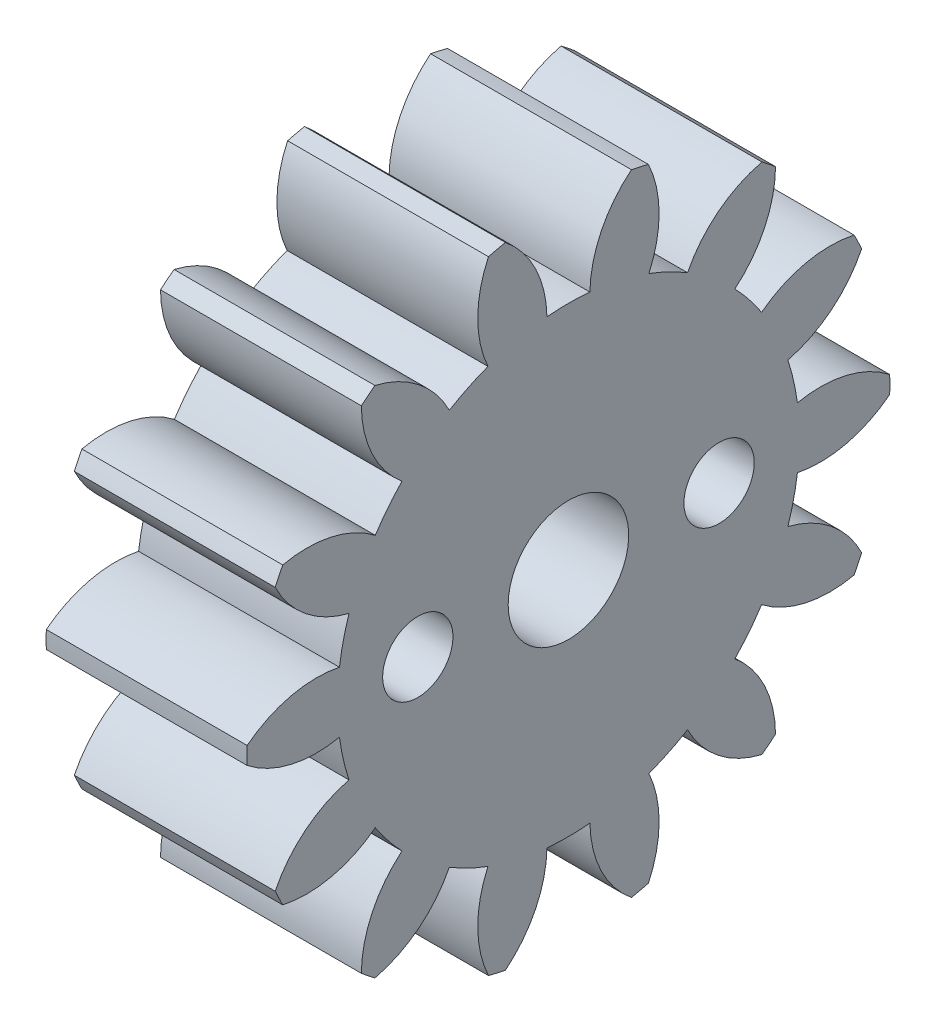
from build123d import *

# Parameters (mm, degrees)
BASPROSKE_W        = 10
BASPROSKE_H        = 16
TOOTHCUT_DEPTH     = 25.738633754
TEETHCUTS_COUNT    = 14
TEETHCUTS_ANGLE    = 334.285714286
BORSKE_R           = 3
BORE_DEPTH         = 50.0000508
HOLE_WIZARD_M3_1_D = 3.5


with BuildPart() as part:
    # BasProSke → Base-Revolve (revolve)
    with BuildSketch(Plane(origin=(0, 0, 0), x_dir=(1, 0, 0), z_dir=(0, 1, 0)), mode=Mode.PRIVATE) as base_revolve_sk:
        with Locations((5, 8)):
            Rectangle(BASPROSKE_W, BASPROSKE_H)
    revolve(base_revolve_sk.sketch.rotate(Axis((-10, 0, 0), (1, 0, 0)), 180), axis=Axis((-10, 0, 0), (1, 0, 0)))

    # TooCutSke → ToothCut (cut, through all)
    with BuildSketch(Plane(origin=(0, 0, 0), x_dir=(0, 0, -1), z_dir=(1, 0, 0))):
        with BuildLine():
            ThreePointArc((1.067858192, 11.449309144), (0, 11.499), (-1.067858192, 11.449309144))
            ThreePointArc((-1.067858192, 11.449309144), (-1.641684211, 13.812780716), (-3.163375005, 15.710076503))
            ThreePointArc((-3.163375005, 15.710076503), (0, 16.0254), (3.163375005, 15.710076503))
            ThreePointArc((3.163375005, 15.710076503), (1.641684211, 13.812780716), (1.067858192, 11.449309144))
        make_face()
    toothcut = extrude(amount=TOOTHCUT_DEPTH, mode=Mode.SUBTRACT)

    # TeethCuts: ToothCut ×14 about axis
    teethcuts_axis = Axis((-10, 0, 0), (1, 0, 0))
    for i in range(1, TEETHCUTS_COUNT):
        add(toothcut.rotate(teethcuts_axis, i * TEETHCUTS_ANGLE / (TEETHCUTS_COUNT - 1)), mode=Mode.SUBTRACT)

    # BorSke → Bore (cut, symmetric)
    with BuildSketch(Plane(origin=(0, 0, 0), x_dir=(0, 0, -1), z_dir=(1, 0, 0))):
        with Locations(Location((0, 0, 0), (0, 0, 180))):
            Circle(BORSKE_R)
    extrude(amount=BORE_DEPTH, both=True, mode=Mode.SUBTRACT)

    # M3 すきま穴1 (through all)
    with Locations(Plane.ZY):
        with Locations((7.5, 0), (-7.5, 0)):
            Hole(HOLE_WIZARD_M3_1_D / 2)


solid = part.part
